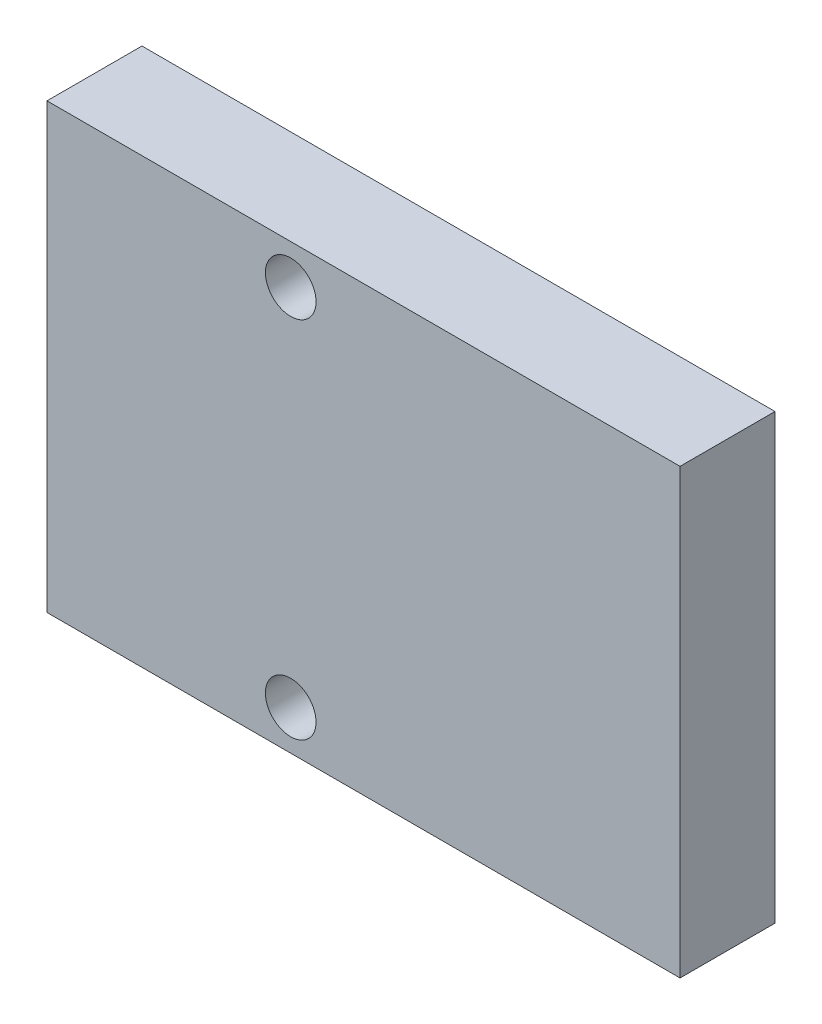
from build123d import *

# Parameters (mm, degrees)
ESQUISSE1_W             = 40
ESQUISSE1_H             = 28
BOSS_EXTRU_1_DEPTH      = 6
ESQUISSE2_R             = 1.6
ENL_V_MAT_EXTRU_1_DEPTH = 10


with BuildPart() as part:
    # Esquisse1 → Boss.-Extru.1 (new body)
    with BuildSketch(Plane.XY):
        with Locations((-20, 14)):
            Rectangle(ESQUISSE1_W, ESQUISSE1_H)
    extrude(amount=BOSS_EXTRU_1_DEPTH)

    # Esquisse2 → Enlèv. mat.-Extru.1 (cut)
    with BuildSketch(Plane(origin=(0, 0, 0), x_dir=(-1, 0, 0), z_dir=(0, 0, -1))):
        with Locations((24.6, 25.5)):
            Circle(ESQUISSE2_R)
        with Locations((24.6, 2.5)):
            Circle(ESQUISSE2_R)
    extrude(amount=-ENL_V_MAT_EXTRU_1_DEPTH, mode=Mode.SUBTRACT)


solid = part.part
